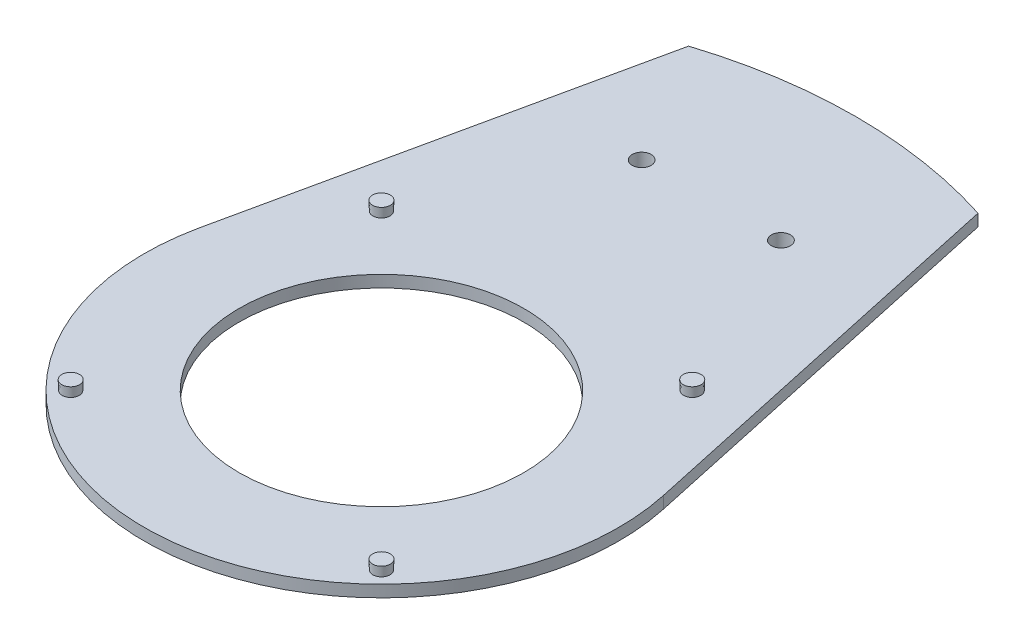
from build123d import *

# Parameters (mm, degrees)
SKETCH1_R                     = 100
SKETCH1_R_2                   = 30
BOSS_EXTRUDE1_DEPTH           = 2.5
SKETCH2_R                     = 1.8
BOSS_EXTRUDE2_DEPTH           = 2
BOSS_EXTRUDE2_DRAFT           = -2
BOSS_EXTRUDE2_PROFILE_2_DEPTH = 2
BOSS_EXTRUDE2_PROFILE_2_DRAFT = -2
BOSS_EXTRUDE2_PROFILE_3_DEPTH = 2
BOSS_EXTRUDE2_PROFILE_3_DRAFT = -2
BOSS_EXTRUDE2_PROFILE_4_DEPTH = 2
BOSS_EXTRUDE2_PROFILE_4_DRAFT = -2
SKETCH5_W                     = 43
SKETCH5_H                     = 30
BOSS_EXTRUDE4_DEPTH           = 2.35
CUT_EXTRUDE1_DEPTH            = 142.492932686
CUT_EXTRUDE1_DEPTH_BACK       = 142.492932686
SKETCH4_R                     = 2
CUT_EXTRUDE2_DEPTH            = 142.492932686


with BuildPart() as part:
    # Sketch1 → Boss-Extrude1 (new body)
    with BuildSketch(Plane(origin=(0, 0, 0), x_dir=(1, 0, 0), z_dir=(0, 1, 0))):
        with Locations(Location((0, 0, 0), (0, 0, 270))):
            Circle(SKETCH1_R)
        with Locations(Location((0, 0, 0), (0, 0, 270))):
            Circle(SKETCH1_R_2, mode=Mode.SUBTRACT)
    extrude(amount=BOSS_EXTRUDE1_DEPTH)


with BuildPart() as boss_extrude2_tool:
    # Sketch2 → Boss-Extrude2 (with draft: the straight prism first)
    with BuildSketch(Plane(origin=(0, 2.5, 0), x_dir=(1, 0, 0), z_dir=(0, 1, 0))):
        with Locations((-32.75, 32.75)):
            Circle(SKETCH2_R)
    extrude(amount=BOSS_EXTRUDE2_DEPTH)
    # Boss-Extrude2: the draft: its side faces are tilted about the plane it starts from
    boss_extrude2_sides = [boss_extrude2_tool.faces().sort_by_distance(p)[0] for p in [
        (-34.55, 3.5, -32.75),
    ]]
    draft(boss_extrude2_sides, Plane(origin=(0, 2.5, 0), x_dir=(1, 0, 0), z_dir=(0, 1, 0)), BOSS_EXTRUDE2_DRAFT)


with BuildPart() as part_1:
    add(part.part)

    # Boss-Extrude2: add boss_extrude2_tool
    add(boss_extrude2_tool.part)


with BuildPart() as boss_extrude2_profile_2_tool:
    # Sketch2 → Boss-Extrude2 profile 2 (with draft: the straight prism first)
    with BuildSketch(Plane(origin=(0, 2.5, 0), x_dir=(1, 0, 0), z_dir=(0, 1, 0))):
        with Locations((-32.75, -32.75)):
            Circle(SKETCH2_R)
    extrude(amount=BOSS_EXTRUDE2_PROFILE_2_DEPTH)
    # Boss-Extrude2 profile 2: the draft: its side faces are tilted about the plane it starts from
    boss_extrude2_profile_2_sides = [boss_extrude2_profile_2_tool.faces().sort_by_distance(p)[0] for p in [
        (-34.55, 3.5, 32.75),
    ]]
    draft(boss_extrude2_profile_2_sides, Plane(origin=(0, 2.5, 0), x_dir=(1, 0, 0), z_dir=(0, 1, 0)), BOSS_EXTRUDE2_PROFILE_2_DRAFT)


with BuildPart() as part_2:
    add(part_1.part)

    # Boss-Extrude2 profile 2: add boss_extrude2_profile_2_tool
    add(boss_extrude2_profile_2_tool.part)


with BuildPart() as boss_extrude2_profile_3_tool:
    # Sketch2 → Boss-Extrude2 profile 3 (with draft: the straight prism first)
    with BuildSketch(Plane(origin=(0, 2.5, 0), x_dir=(1, 0, 0), z_dir=(0, 1, 0))):
        with Locations((32.75, -32.75)):
            Circle(SKETCH2_R)
    extrude(amount=BOSS_EXTRUDE2_PROFILE_3_DEPTH)
    # Boss-Extrude2 profile 3: the draft: its side faces are tilted about the plane it starts from
    boss_extrude2_profile_3_sides = [boss_extrude2_profile_3_tool.faces().sort_by_distance(p)[0] for p in [
        (30.95, 3.5, 32.75),
    ]]
    draft(boss_extrude2_profile_3_sides, Plane(origin=(0, 2.5, 0), x_dir=(1, 0, 0), z_dir=(0, 1, 0)), BOSS_EXTRUDE2_PROFILE_3_DRAFT)


with BuildPart() as part_3:
    add(part_2.part)

    # Boss-Extrude2 profile 3: add boss_extrude2_profile_3_tool
    add(boss_extrude2_profile_3_tool.part)


with BuildPart() as boss_extrude2_profile_4_tool:
    # Sketch2 → Boss-Extrude2 profile 4 (with draft: the straight prism first)
    with BuildSketch(Plane(origin=(0, 2.5, 0), x_dir=(1, 0, 0), z_dir=(0, 1, 0))):
        with Locations((32.75, 32.75)):
            Circle(SKETCH2_R)
    extrude(amount=BOSS_EXTRUDE2_PROFILE_4_DEPTH)
    # Boss-Extrude2 profile 4: the draft: its side faces are tilted about the plane it starts from
    boss_extrude2_profile_4_sides = [boss_extrude2_profile_4_tool.faces().sort_by_distance(p)[0] for p in [
        (30.95, 3.5, -32.75),
    ]]
    draft(boss_extrude2_profile_4_sides, Plane(origin=(0, 2.5, 0), x_dir=(1, 0, 0), z_dir=(0, 1, 0)), BOSS_EXTRUDE2_PROFILE_4_DRAFT)


with BuildPart() as part_4:
    add(part_3.part)

    # Boss-Extrude2 profile 4: add boss_extrude2_profile_4_tool
    add(boss_extrude2_profile_4_tool.part)

    # Sketch5 → Boss-Extrude4 (add)
    with BuildSketch(Plane.XZ):
        with Locations((0, -69.45)):
            Rectangle(SKETCH5_W, SKETCH5_H)
    extrude(amount=BOSS_EXTRUDE4_DEPTH)

    # Sketch4 → Cut-Extrude1 (cut, two sides: drawn at the far end of the back side and taken through both)
    with BuildSketch(Plane.XZ.offset(-CUT_EXTRUDE1_DEPTH_BACK)):
        with Locations(Location((-14.675074607, -69.517945059, 0), (0, 0, 270))):
            Circle(SKETCH4_R)
        with Locations(Location((14.675074607, -69.517945059, 0), (0, 0, 270))):
            Circle(SKETCH4_R)
    extrude(amount=CUT_EXTRUDE1_DEPTH + CUT_EXTRUDE1_DEPTH_BACK, mode=Mode.SUBTRACT)

    # Sketch6 → Cut-Extrude2 (cut, through all)
    with BuildSketch(Plane.XZ):
        with BuildLine():
            Line((48.863066456, -10.601921361), (30.5, -95.235235076))
            ThreePointArc((30.5, -95.235235076), (80.777472107, -58.949130613), (100, 0))
            ThreePointArc((100, 0), (-58.949130613, 80.777472107), (-30.5, -95.235235076))
            Line((-30.5, -95.235235076), (-48.863066456, -10.601921361))
            ThreePointArc((-48.863066456, -10.601921361), (-5.331354294, 49.714954102), (50, 0))
            ThreePointArc((50, 0), (49.714954102, -5.331354294), (48.863066456, -10.601921361))
        make_face()
    extrude(amount=-CUT_EXTRUDE2_DEPTH, mode=Mode.SUBTRACT)


solid = part_4.part
